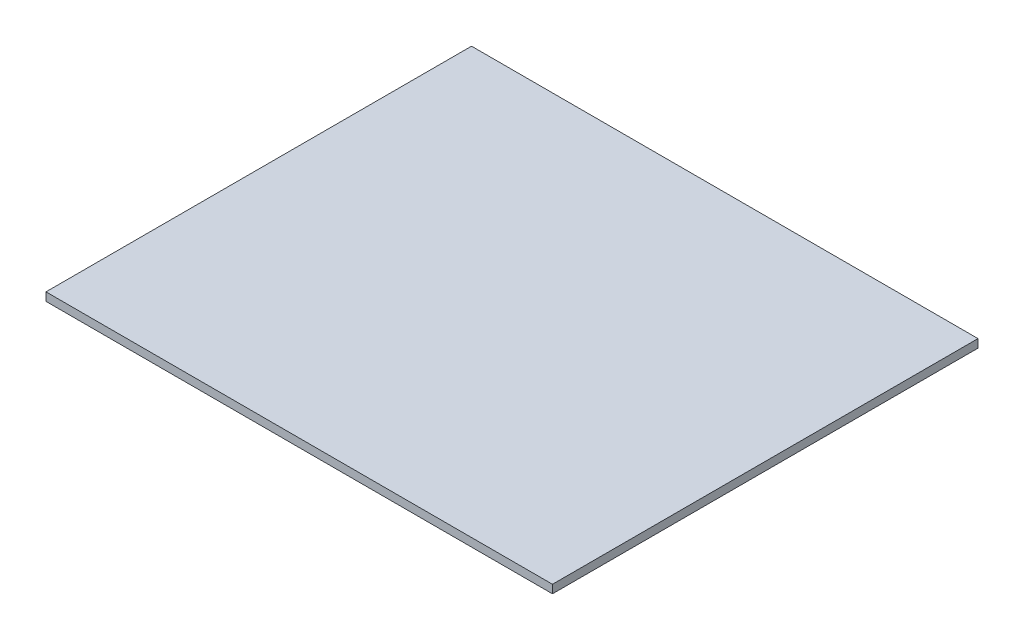
from build123d import *

# Parameters (mm, degrees)
SKETCH2_W           = 488
SKETCH2_H           = 410
BOSS_EXTRUDE1_DEPTH = 8


with BuildPart() as part:
    # Sketch2 → Boss-Extrude1 (new body)
    with BuildSketch(Plane(origin=(0, 0, 0), x_dir=(1, 0, 0), z_dir=(0, 1, 0))):
        with Locations((244, 205)):
            Rectangle(SKETCH2_W, SKETCH2_H)
    extrude(amount=BOSS_EXTRUDE1_DEPTH)


solid = part.part
